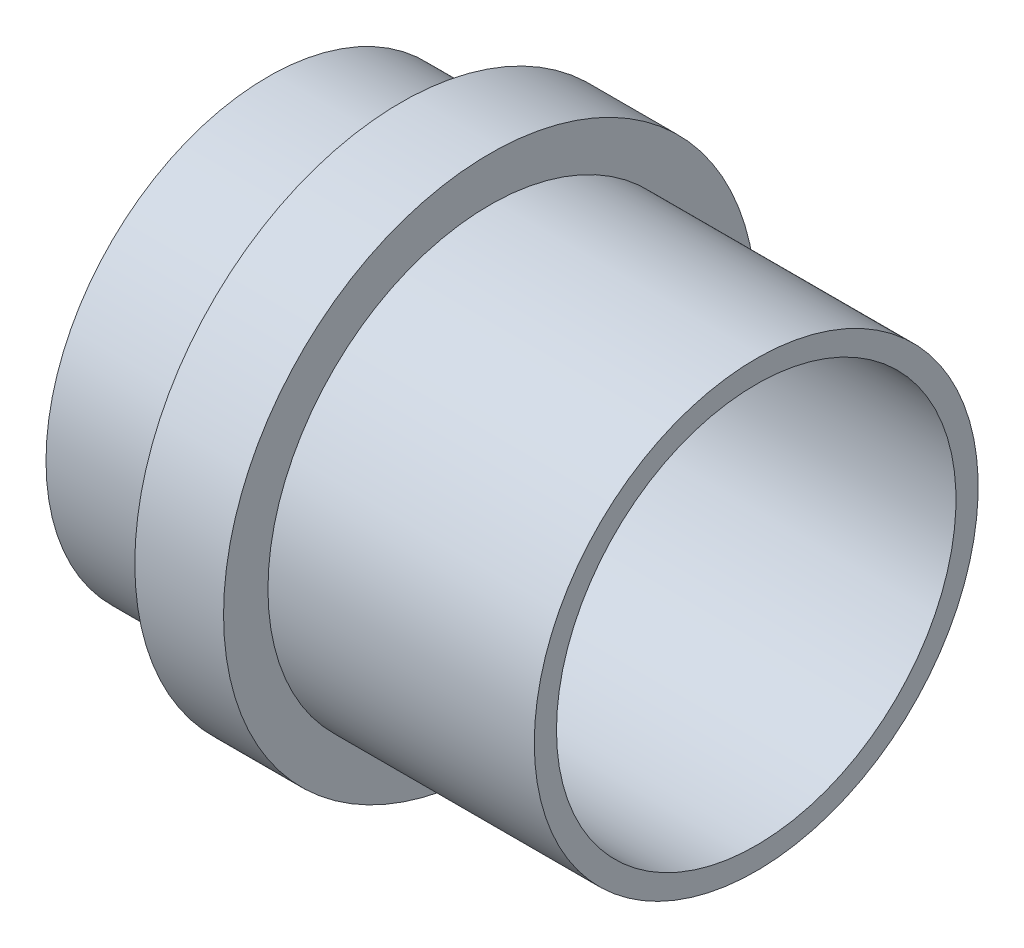
from build123d import *


with BuildPart() as part:
    # Sketch2 → Revolve1 (revolve)
    with BuildSketch(Plane.XY, mode=Mode.PRIVATE) as revolve1_sk:
        Polygon((38.1, 57.15), (0, 57.15), (0, 63.5), (38.1, 63.5), (38.1, 76.2), (63.5, 76.2), (63.5, 63.5), (127, 63.5), (139.7, 63.5), (139.7, 57.15), align=None)
    revolve(revolve1_sk.sketch.rotate(Axis((0, 0, 0), (1, 0, 0)), 90), axis=Axis((0, 0, 0), (1, 0, 0)))


solid = part.part
